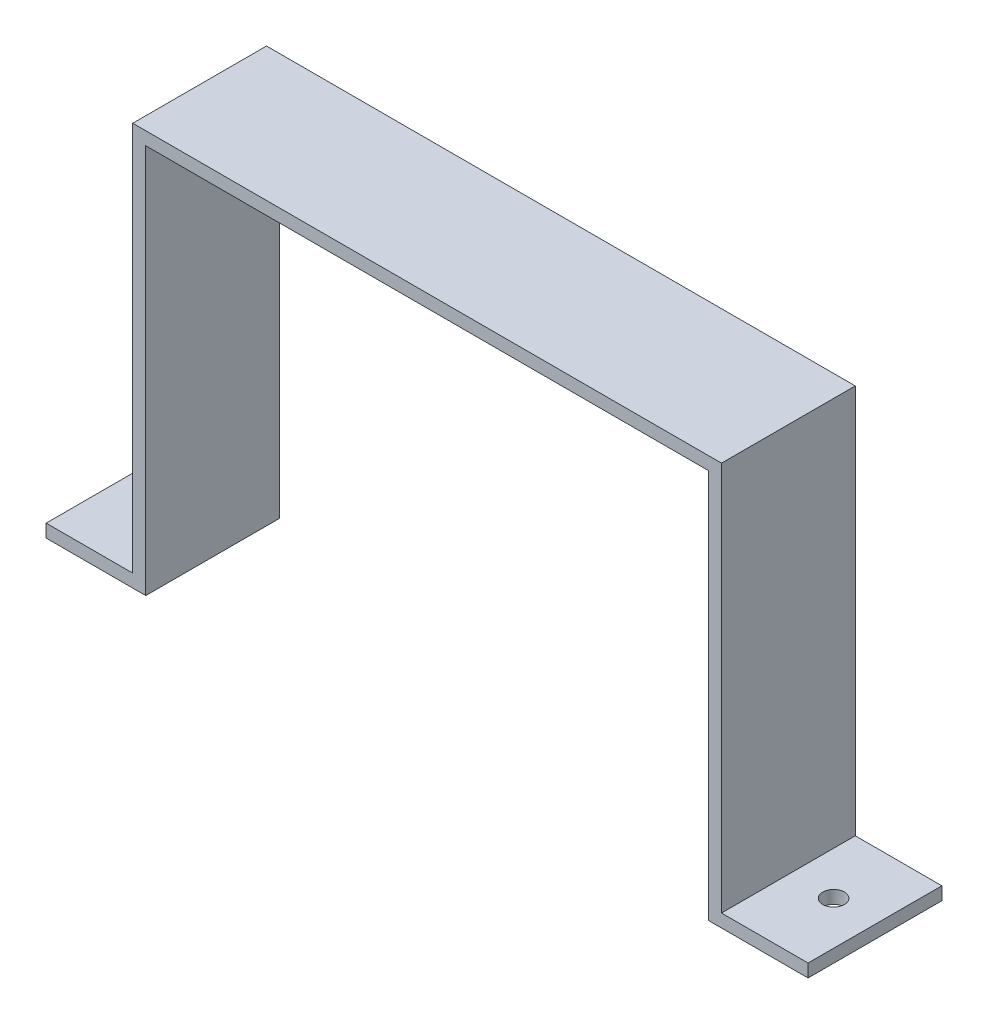
from build123d import *

# Parameters (mm, degrees)
BOSS_EXTRUDE1_DEPTH   = 30.9
F_5_0MM_DOWEL_HOLE1_D = 5


with BuildPart() as part:
    # Sketch1 → Boss-Extrude1 (new body)
    with BuildSketch(Plane.XY):
        Polygon((3, 0), (133, 0), (133, -90), (136, -90), (156, -90), (156, -87), (136, -87), (136, 0), (136, 3), (0, 3), (0, 0), (0, -87), (-20, -87), (-20, -90), (0, -90), (3, -90), align=None)
    extrude(amount=BOSS_EXTRUDE1_DEPTH)

    # Ø5.0mm Dowel Hole1 (through all)
    with Locations(Plane(origin=(0, -87, 0), x_dir=(1, 0, 0), z_dir=(0, 1, 0))):
        with Locations((-10, -15), (146, -15)):
            Hole(F_5_0MM_DOWEL_HOLE1_D / 2)


solid = part.part
